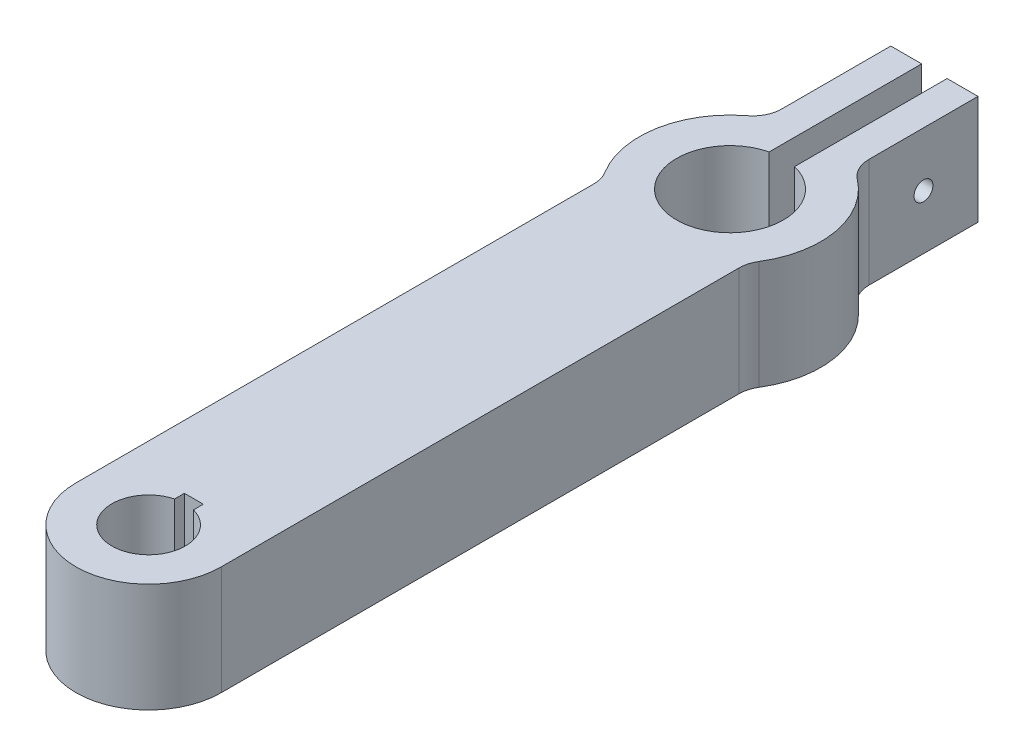
from build123d import *

# Parameters (mm, degrees)
SKETCH2_R           = 12.827
BOSS_EXTRUDE1_DEPTH = 38.1
CUT_EXTRUDE1_REACH  = 283.22
SKETCH3_R           = 3.302
SKETCH4_W           = 23.114
SKETCH4_H           = 31.75
CUT_EXTRUDE2_DEPTH  = 5.08
SKETCH5_W           = 9.525
SKETCH5_H           = 38.1
CUT_EXTRUDE3_DEPTH  = 5.08
CUT_EXTRUDE4_REACH  = 281.078
SKETCH6_W           = 6.604
SKETCH6_H           = 3.429


with BuildPart() as part:
    # Sketch2 → Boss-Extrude1 (new body)
    with BuildSketch(Plane(origin=(0, 0, 0), x_dir=(1, 0, 0), z_dir=(0, 1, 0))):
        with BuildLine():
            Line((-25.4, 0), (-25.4, 181.02040352))
            ThreePointArc((-25.4, 181.02040352), (-25.79242718, 183.816851484), (-26.939393939, 186.397275394))
            ThreePointArc((-26.939393939, 186.397275394), (-31.231288537, 208.915690363), (-19.242424242, 228.45453641))
            ThreePointArc((-19.242424242, 228.45453641), (-16.295425059, 232.026851209), (-15.24, 236.535988061))
            Line((-15.24, 236.535988061), (-15.24, 274.635988061))
            Line((-15.24, 274.635988061), (-4.445, 274.635988061))
            Line((-4.445, 274.635988061), (-4.445, 221.33211339))
            ThreePointArc((-4.445, 221.33211339), (0, 184.531), (4.445, 221.33211339))
            Line((4.445, 221.33211339), (4.445, 274.635988061))
            Line((4.445, 274.635988061), (15.24, 274.635988061))
            Line((15.24, 274.635988061), (15.24, 236.535988061))
            ThreePointArc((15.24, 236.535988061), (16.295425059, 232.026851209), (19.242424242, 228.45453641))
            ThreePointArc((19.242424242, 228.45453641), (31.231288537, 208.915690363), (26.939393939, 186.397275394))
            ThreePointArc((26.939393939, 186.397275394), (25.79242718, 183.816851484), (25.4, 181.02040352))
            Line((25.4, 181.02040352), (25.4, 0))
            ThreePointArc((25.4, 0), (0, -25.4), (-25.4, 0))
        make_face()
        with Locations(Location((0, 0, 0), (0, 0, 90))):
            Circle(SKETCH2_R, mode=Mode.SUBTRACT)
    extrude(amount=BOSS_EXTRUDE1_DEPTH)

    # Cut-Extrude1: up to this face of the body (flat: up to its plane)
    cut_extrude1_end = Plane(part.part.faces().sort_by_distance((15.24, 19.05, -255.585988061))[0])
    # Sketch3 → Cut-Extrude1 (cut, up to the picked face)
    with BuildSketch(Plane.ZY.offset(15.24), mode=Mode.PRIVATE) as cut_extrude1_sk1:
        with Locations((-255.585988061, 19.05)):
            Circle(SKETCH3_R)
    cut_extrude1_tool1 = split(extrude(cut_extrude1_sk1.sketch, amount=-CUT_EXTRUDE1_REACH, mode=Mode.PRIVATE), bisect_by=cut_extrude1_end, keep=Keep.BOTH, mode=Mode.PRIVATE)
    add(cut_extrude1_tool1.solids().sort_by(Axis((-15.24, 19.05, -255.585988), (1, 0, 0)))[0], mode=Mode.SUBTRACT)

    # Sketch4 → Cut-Extrude2 (cut)
    with BuildSketch(Plane.XZ):
        with Locations((0, -101.6)):
            Rectangle(SKETCH4_W, SKETCH4_H)
    extrude(amount=-CUT_EXTRUDE2_DEPTH, mode=Mode.SUBTRACT)

    # Sketch5 → Cut-Extrude3 (cut)
    with BuildSketch(Plane.XZ):
        with Locations((0, -66.675)):
            Rectangle(SKETCH5_W, SKETCH5_H)
    extrude(amount=-CUT_EXTRUDE3_DEPTH, mode=Mode.SUBTRACT)

    # Sketch6 → Cut-Extrude4 (cut, up to next)
    with BuildSketch(Plane.XZ, mode=Mode.PRIVATE) as cut_extrude4_sk1:
        with Locations((0, -14.109205523)):
            Rectangle(SKETCH6_W, SKETCH6_H)
    cut_extrude4_tool1 = extrude(cut_extrude4_sk1.sketch, amount=-CUT_EXTRUDE4_REACH, mode=Mode.PRIVATE) & part.part
    add(cut_extrude4_tool1.solids().sort_by_distance((0, 0, -14.109206))[0], mode=Mode.SUBTRACT)


solid = part.part
